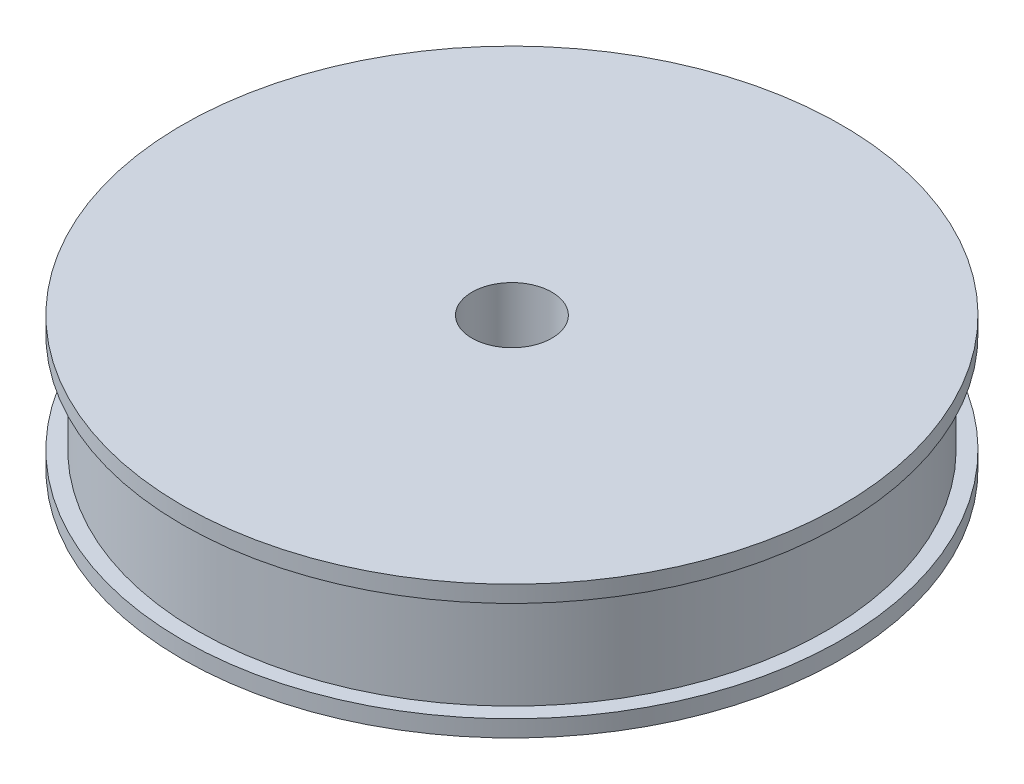
from build123d import *


with BuildPart() as part:
    # Schizzo1 → Rivoluzione1 (revolve)
    with BuildSketch(Plane.XY, mode=Mode.PRIVATE) as rivoluzione1_sk:
        Polygon((6, -7.661290323), (49.5, -7.661290323), (49.5, -5.161290323), (47.175, -5.161290323), (47.175, 9.838709677), (49.5, 9.838709677), (49.5, 12.338709677), (6, 12.338709677), align=None)
    revolve(rivoluzione1_sk.sketch.rotate(Axis((0, 12.338709677, 0), (0, -1, 0)), 90), axis=Axis((0, 12.338709677, 0), (0, -1, 0)))


solid = part.part
